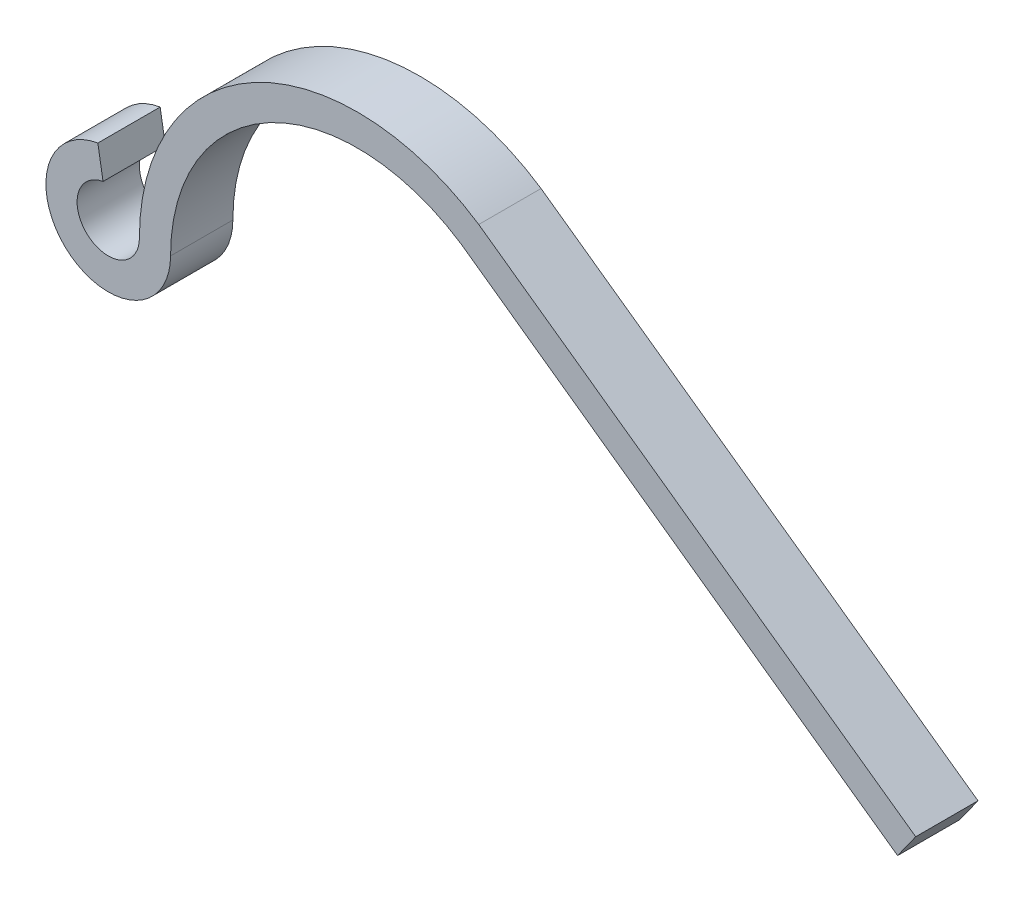
from build123d import *

# Parameters (mm, degrees)
BASE_EXTRUDE_DEPTH = 10


with BuildPart() as part:
    # Sketch1 → Base-Extrude (new body)
    with BuildSketch(Plane.XY):
        with BuildLine():
            Line((89.567268983, -20.929801144), (19.452075124, 29.096679766))
            ThreePointArc((19.452075124, 29.096679766), (-16.495110953, 30.869261648), (-35, 0))
            ThreePointArc((-35, 0), (-43.227486122, -3.818813079), (-40.833333333, 4.930066486))
            Line((-40.833333333, 4.930066486), (-41.666666667, 9.860132972))
            ThreePointArc((-41.666666667, 9.860132972), (-46.454972244, -7.637626158), (-30, 0))
            ThreePointArc((-30, 0), (-14.170913912, 26.442110334), (16.612346594, 24.980591279))
            Line((16.612346594, 24.980591279), (86.66322331, -25))
            Line((86.66322331, -25), (89.567268983, -20.929801144))
        make_face()
    extrude(amount=BASE_EXTRUDE_DEPTH)


solid = part.part
